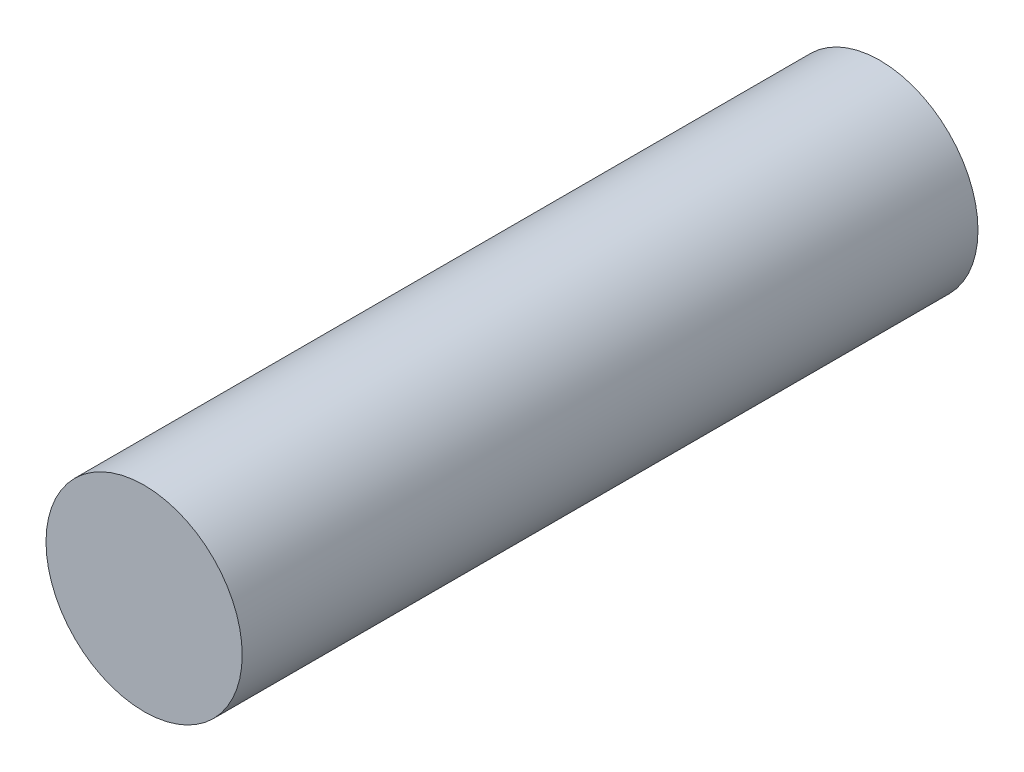
from build123d import *

# Parameters (mm, degrees)
SKETCH1_R           = 12.7
BOSS_EXTRUDE1_DEPTH = 95.25
CUT_EXTRUDE1_DEPTH  = 39.878


with BuildPart() as part:
    # Sketch1 → Boss-Extrude1 (new body)
    with BuildSketch(Plane.XY):
        Circle(SKETCH1_R)
    extrude(amount=BOSS_EXTRUDE1_DEPTH)

    # Sketch2 → Cut-Extrude1 (cut)
    with BuildSketch(Plane(origin=(0, 0, 0), x_dir=(-1, 0, 0), z_dir=(0, 0, -1))):
        Polygon((6.35, 3.666174209), (0, 7.332348419), (-6.35, 3.666174209), (-6.35, -3.666174209), (0, -7.332348419), (6.35, -3.666174209), align=None)
    extrude(amount=-CUT_EXTRUDE1_DEPTH, mode=Mode.SUBTRACT)


solid = part.part
